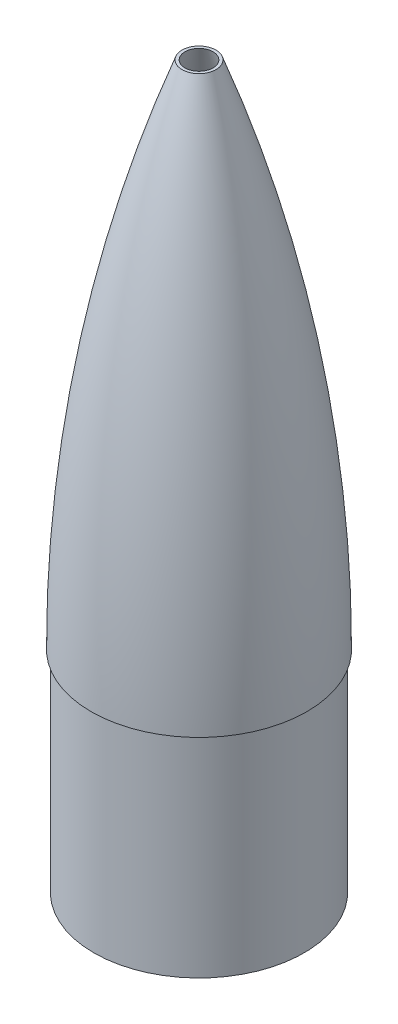
from build123d import *

# Parameters (mm, degrees)
BOSS_EXTRUDE1_DEPTH      = 10
BOSS_EXTRUDE1_DEPTH_BACK = 152.4
SKETCH2_R                = 76.2
SKETCH2_R_2              = 74.2
SKETCH6_R                = 45.027407712
CUT_EXTRUDE1_DEPTH       = 40


with BuildPart() as part:
    # Sketch1 → Revolve3 (revolve)
    with BuildSketch(Plane.XY):
        with BuildLine():
            Line((0, 400), (0, 401.853426775))
            ThreePointArc((0, 401.853426775), (58.468341276, 204.695759977), (78.2, 0))
            Line((78.2, 0), (76.2, 0))
            ThreePointArc((76.2, 0), (56.977268898, 201.872568324), (0, 396.489212171))
            Line((0, 396.489212171), (0, 400))
        make_face()
    revolve(axis=Axis((0, 400, 0), (0, 1, 0)))

    # Sketch2 → Boss-Extrude1 (add, two sides: drawn at the far end of the back side and taken through both)
    with BuildSketch(Plane(origin=(0, 0, 0), x_dir=(1, 0, 0), z_dir=(0, 1, 0)).offset(-BOSS_EXTRUDE1_DEPTH_BACK)):
        with Locations(Location((0, 0, 0), (0, 0, 90))):
            Circle(SKETCH2_R)
        with Locations(Location((0, 0, 0), (0, 0, 270))):
            Circle(SKETCH2_R_2, mode=Mode.SUBTRACT)
    extrude(amount=BOSS_EXTRUDE1_DEPTH + BOSS_EXTRUDE1_DEPTH_BACK)

    # Sketch6 → Cut-Extrude1 (cut)
    with BuildSketch(Plane(origin=(0, 370, 0), x_dir=(-1, 0, 0), z_dir=(0, -1, 0))):
        Circle(SKETCH6_R)
    extrude(amount=-CUT_EXTRUDE1_DEPTH, mode=Mode.SUBTRACT)


solid = part.part
